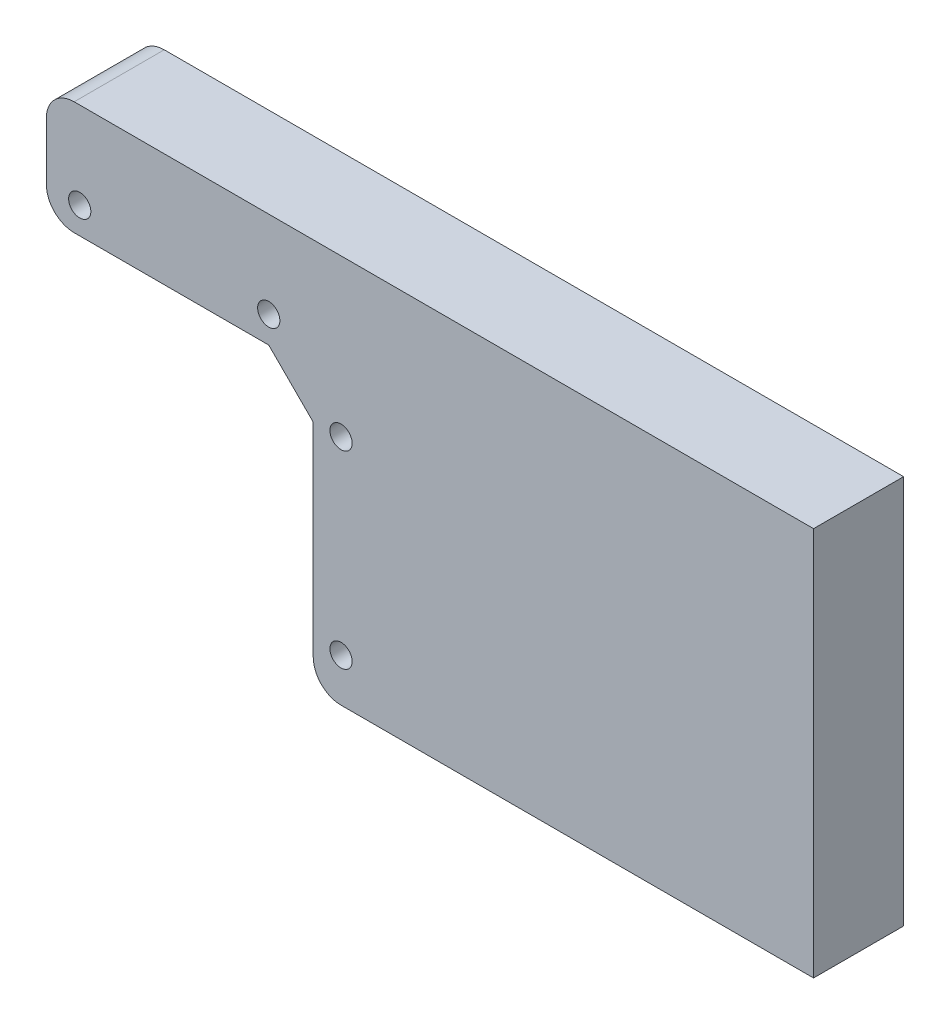
from build123d import *

# Parameters (mm, degrees)
ESQUISSE1_W             = 45
ESQUISSE1_H             = 35
BOSS_EXTRU_1_DEPTH      = 8.1
ESQUISSE2_W             = 24
ESQUISSE2_H             = 10.2
BOSS_EXTRU_2_DEPTH      = 8.1
ESQUISSE3_R             = 1
ENL_V_MAT_EXTRU_1_DEPTH = 58.581333781
CHANFREIN1_SIZE         = 4
CONG_1_R                = 2.5


with BuildPart() as part:
    # Esquisse1 → Boss.-Extru.1 (new body)
    with BuildSketch(Plane.XY):
        with Locations((22.5, 17.5)):
            Rectangle(ESQUISSE1_W, ESQUISSE1_H)
    extrude(amount=BOSS_EXTRU_1_DEPTH)

    # Esquisse2 → Boss.-Extru.2 (add)
    with BuildSketch(Plane.XY.offset(8.1)):
        with Locations((-12, 29.9)):
            Rectangle(ESQUISSE2_W, ESQUISSE2_H)
    extrude(amount=-BOSS_EXTRU_2_DEPTH)

    # Esquisse3 → Enlèv. mat.-Extru.1 (cut, through all)
    with BuildSketch(Plane.XY.offset(8.1)):
        with Locations((-4, 27.2)):
            Circle(ESQUISSE3_R)
        with Locations((-21, 27.2)):
            Circle(ESQUISSE3_R)
        with Locations((2.5, 20.9)):
            Circle(ESQUISSE3_R)
        with Locations((2.5, 3.9)):
            Circle(ESQUISSE3_R)
    extrude(amount=-ENL_V_MAT_EXTRU_1_DEPTH, mode=Mode.SUBTRACT)

    # Chanfrein1
    chanfrein1_edges = [part.edges().sort_by_distance(p)[0] for p in [
        (0, 24.8, 4.05),
    ]]
    chamfer(chanfrein1_edges, length=CHANFREIN1_SIZE)

    # Congé1
    cong_1_edges = [part.edges().sort_by_distance(p)[0] for p in [
        (-24, 24.8, 4.05),
        (-24, 35, 4.05),
        (0, 0, 4.05),
    ]]
    fillet(cong_1_edges, radius=CONG_1_R)


solid = part.part
